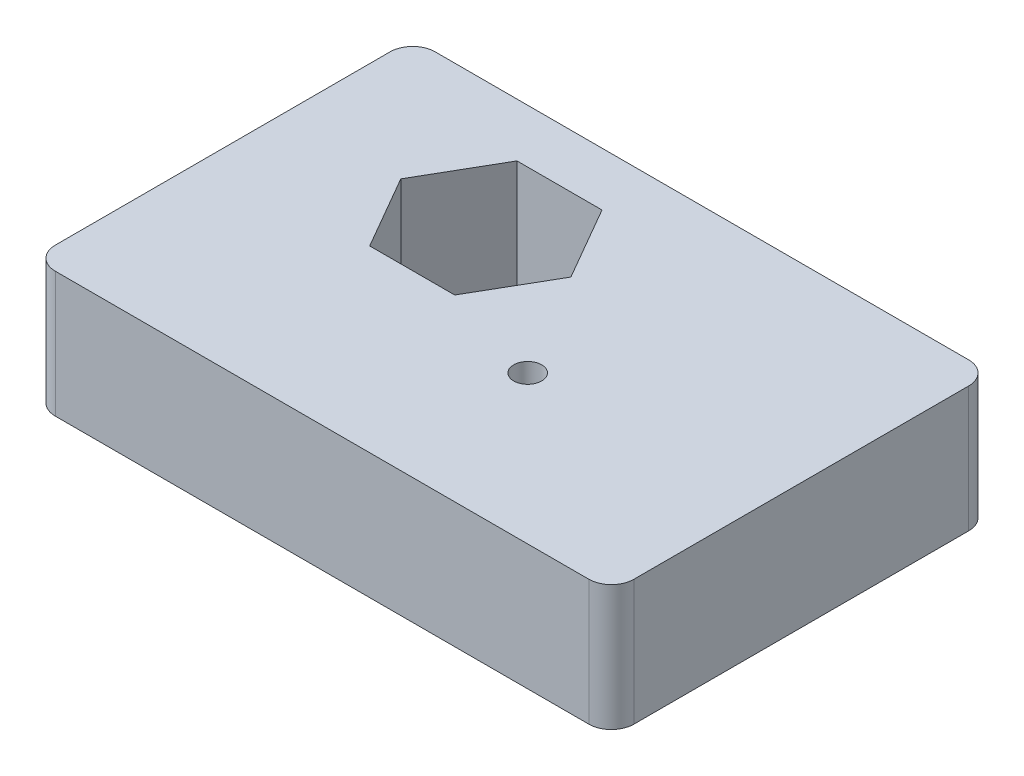
from build123d import *

# Parameters (mm, degrees)
SKETCH1_W           = 27.5
SKETCH1_H           = 18
SKETCH1_R           = 0.75
BOSS_EXTRUDE1_DEPTH = 6
FILLET1_R           = 1
MOVE_FACE1_BY       = 0.08
MOVE_FACE1_2_BY     = 0.08
MOVE_FACE1_3_BY     = 0.08
MOVE_FACE1_4_BY     = 0.08
MOVE_FACE1_5_BY     = 0.08
MOVE_FACE1_6_BY     = 0.08
MOVE_FACE1_7_BY     = 0.08
MOVE_FACE1_8_BY     = 0.08
MOVE_FACE1_9_BY     = 0.08
MOVE_FACE1_10_BY    = 0.08
MOVE_FACE1_11_BY    = 0.08
MOVE_FACE1_12_BY    = 0.08
MOVE_FACE1_13_BY    = 0.08
MOVE_FACE1_14_BY    = 0.08
MOVE_FACE1_15_BY    = 0.08


with BuildPart() as part:
    # Sketch1 → Boss-Extrude1 (new body)
    with BuildSketch(Plane(origin=(0, 0, 0), x_dir=(1, 0, 0), z_dir=(0, 1, 0))):
        with Locations((13.75, 9)):
            Rectangle(SKETCH1_W, SKETCH1_H)
        with Locations(Location((16.5, 7, 0), (0, 0, 270))):
            Circle(SKETCH1_R, mode=Mode.SUBTRACT)
        Polygon((13.656921938, 12), (11.578460969, 15.6), (7.421539031, 15.6), (5.343078062, 12), (7.421539031, 8.4), (11.578460969, 8.4), align=None, mode=Mode.SUBTRACT)
    extrude(amount=BOSS_EXTRUDE1_DEPTH)

    # Fillet1
    fillet1_edges = [part.edges().sort_by_distance(p)[0] for p in [
        (0, 3, -18),
        (27.5, 3, -18),
        (27.5, 3, 0),
        (0, 3, 0),
    ]]
    fillet(fillet1_edges, radius=FILLET1_R)

    # Move Face1: a curved face moved outward by 0.08
    add(Solid.thicken(part.faces().sort_by_distance((16.5, 3, -7.75))[0], MOVE_FACE1_BY))

    # Move Face1 2: a face moved outward by 0.08
    extrude(part.faces().sort_by_distance((12.617691454, 3, -13.8))[0], amount=MOVE_FACE1_2_BY, dir=(-0.866025404, 0, 0.5))

    # Move Face1 3: a face moved outward by 0.08
    extrude(part.faces().sort_by_distance((9.5, 3, -15.6))[0], amount=MOVE_FACE1_3_BY, dir=(0, 0, 1))

    # Move Face1 4: a curved face moved outward by 0.08
    add(Solid.thicken(part.faces().sort_by_distance((27.207106781, 3, -0.292893219))[0], MOVE_FACE1_4_BY))

    # Move Face1 5: a face moved outward by 0.08
    extrude(part.faces().sort_by_distance((27.5, 3, -9))[0], amount=MOVE_FACE1_5_BY, dir=(1, 0, 0))

    # Move Face1 6: a curved face moved outward by 0.08
    add(Solid.thicken(part.faces().sort_by_distance((27.207106781, 3, -17.707106781))[0], MOVE_FACE1_6_BY))

    # Move Face1 7: a face moved outward by 0.08
    extrude(part.faces().sort_by_distance((13.75, 3, -18))[0], amount=MOVE_FACE1_7_BY, dir=(0, 0, -1))

    # Move Face1 8: a curved face moved outward by 0.08
    add(Solid.thicken(part.faces().sort_by_distance((0.292893219, 3, -17.707106781))[0], MOVE_FACE1_8_BY))

    # Move Face1 9: a face moved outward by 0.08
    extrude(part.faces().sort_by_distance((0, 3, -9))[0], amount=MOVE_FACE1_9_BY, dir=(-1, 0, 0))

    # Move Face1 10: a curved face moved outward by 0.08
    add(Solid.thicken(part.faces().sort_by_distance((0.292893219, 3, -0.292893219))[0], MOVE_FACE1_10_BY))

    # Move Face1 11: a face moved outward by 0.08
    extrude(part.faces().sort_by_distance((13.75, 3, 0))[0], amount=MOVE_FACE1_11_BY, dir=(0, 0, 1))

    # Move Face1 12: a face moved outward by 0.08
    extrude(part.faces().sort_by_distance((6.382308546, 3, -13.8))[0], amount=MOVE_FACE1_12_BY, dir=(0.866025404, 0, 0.5))

    # Move Face1 13: a face moved outward by 0.08
    extrude(part.faces().sort_by_distance((9.5, 3, -8.4))[0], amount=MOVE_FACE1_13_BY, dir=(0, 0, -1))

    # Move Face1 14: a face moved outward by 0.08
    extrude(part.faces().sort_by_distance((6.382308546, 3, -10.2))[0], amount=MOVE_FACE1_14_BY, dir=(0.866025404, 0, -0.5))

    # Move Face1 15: a face moved outward by 0.08
    extrude(part.faces().sort_by_distance((12.617691454, 3, -10.2))[0], amount=MOVE_FACE1_15_BY, dir=(-0.866025404, 0, -0.5))


solid = part.part
